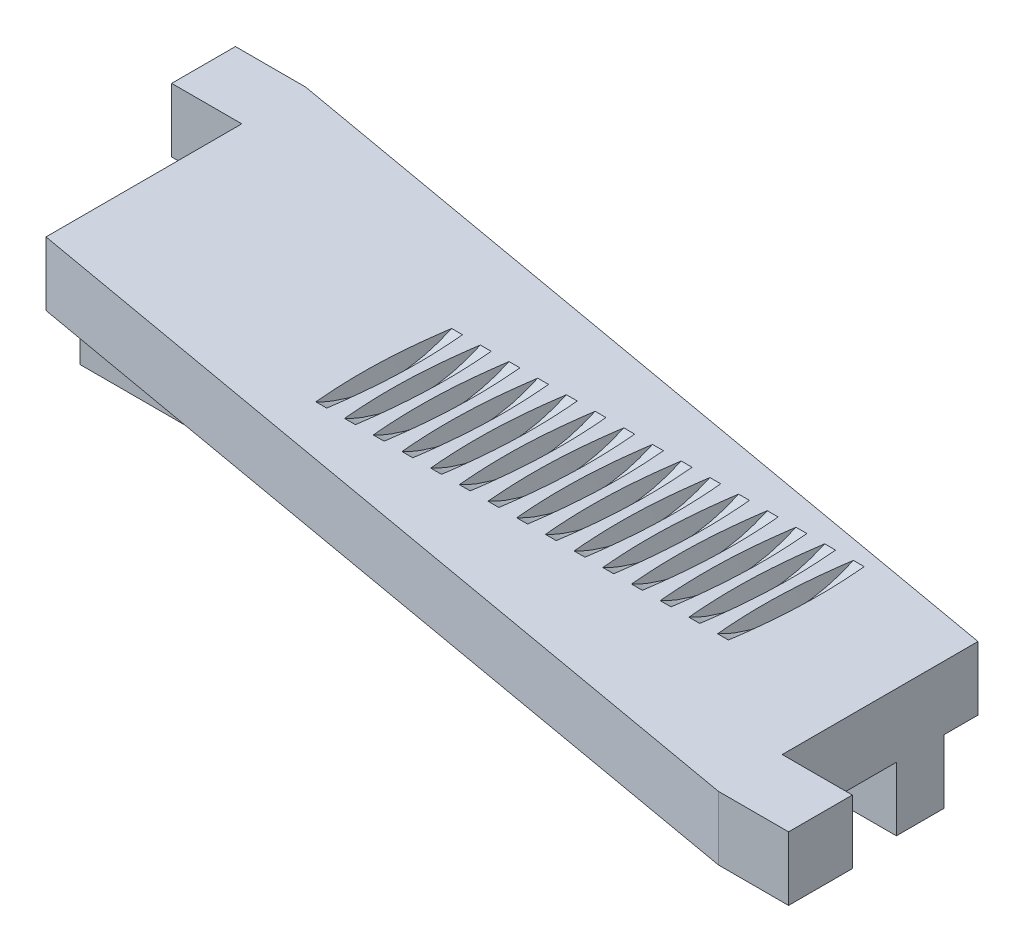
from build123d import *

# Parameters (mm, degrees)
BOSS_EXTRUDE1_DEPTH = 10
CUT_SWEEP2_PITCH    = 4.5
CUT_SWEEP2_HEIGHT   = 64.5
CUT_SWEEP2_RADIUS   = 22.5
SKETCH13_W          = 128.025007892
SKETCH13_H          = 7.5
BOSS_EXTRUDE4_DEPTH = 10


with BuildPart() as part:
    # Sketch1 → Boss-Extrude1 (new body)
    with BuildSketch(Plane(origin=(0, 0, 0), x_dir=(1, 0, 0), z_dir=(0, 1, 0))):
        Polygon((0, 0), (-128.025007892, 22.574263097), (-128.025007892, 53.279999997), (-139.025007892, 53.279999997), (-139.025007892, 63.279999997), (-128.025007892, 63.279999997), (0, 40.7057369), (0, 10), (11, 10), (11, 0), align=None)
    extrude(amount=BOSS_EXTRUDE1_DEPTH)

    # Cut-Sweep2: sweep along a helix
    with BuildLine() as cut_sweep2_path:
        Helix(CUT_SWEEP2_PITCH, CUT_SWEEP2_HEIGHT, CUT_SWEEP2_RADIUS, center=(-20, 30, -31.64), direction=(-1, 0, 0))
    # Sketch12 → Cut-Sweep2 (sweep, cut)
    with BuildSketch(Plane(origin=(0, 30, 0), x_dir=(1, 0, 0), z_dir=(0, 1, 0))):
        Polygon((-20.698267478, 51.44), (-17.601732522, 51.44), (-18.3, 54.14), (-20, 54.14), align=None)
    sweep(path=cut_sweep2_path.line, is_frenet=True, mode=Mode.SUBTRACT)

    # Sketch13 → Boss-Extrude4 (add)
    with BuildSketch(Plane.XZ):
        with Locations((-64.012503946, -31.6557369)):
            Rectangle(SKETCH13_W, SKETCH13_H)
    extrude(amount=BOSS_EXTRUDE4_DEPTH)


solid = part.part
